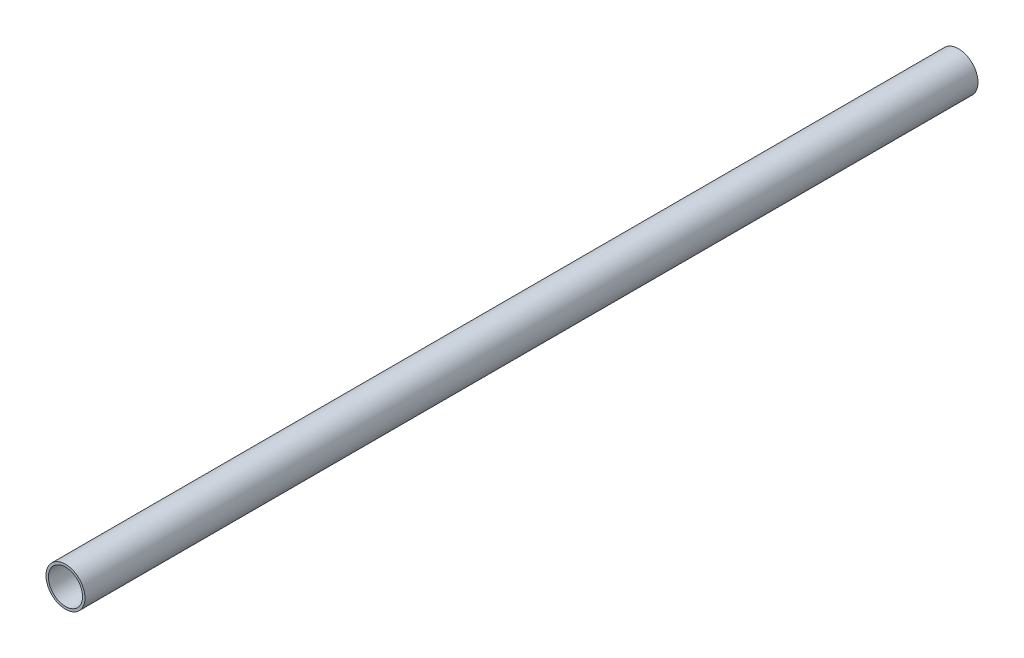
from build123d import *

# Parameters (mm, degrees)
SKETCH2_R           = 12.7
SKETCH2_R_2         = 11.1125
BOSS_EXTRUDE1_DEPTH = 290.521999981


with BuildPart() as part:
    # Sketch2 → Boss-Extrude1 (new, symmetric)
    with BuildSketch(Plane.XY):
        Circle(SKETCH2_R)
        Circle(SKETCH2_R_2, mode=Mode.SUBTRACT)
    extrude(amount=BOSS_EXTRUDE1_DEPTH, both=True)


solid = part.part
